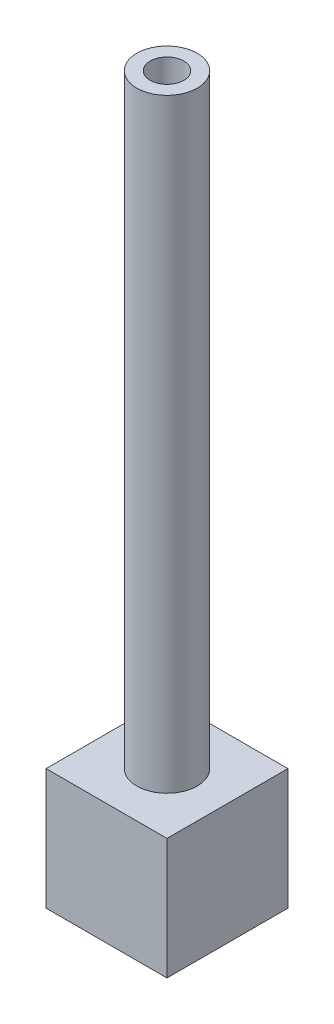
from build123d import *

# Parameters (mm, degrees)
SKETCH1_R           = 5
SKETCH1_R_2         = 2.78
BOSS_EXTRUDE1_DEPTH = 100
SKETCH2_W           = 20
SKETCH2_H           = 20
BOSS_EXTRUDE2_DEPTH = 20


with BuildPart() as part:
    # Sketch1 → Boss-Extrude1 (new body)
    with BuildSketch(Plane(origin=(0, 0, 0), x_dir=(1, 0, 0), z_dir=(0, 1, 0))):
        Circle(SKETCH1_R)
        Circle(SKETCH1_R_2, mode=Mode.SUBTRACT)
    extrude(amount=BOSS_EXTRUDE1_DEPTH)

    # Sketch2 → Boss-Extrude2 (add)
    with BuildSketch(Plane.XZ):
        Rectangle(SKETCH2_W, SKETCH2_H)
    extrude(amount=BOSS_EXTRUDE2_DEPTH)


solid = part.part
